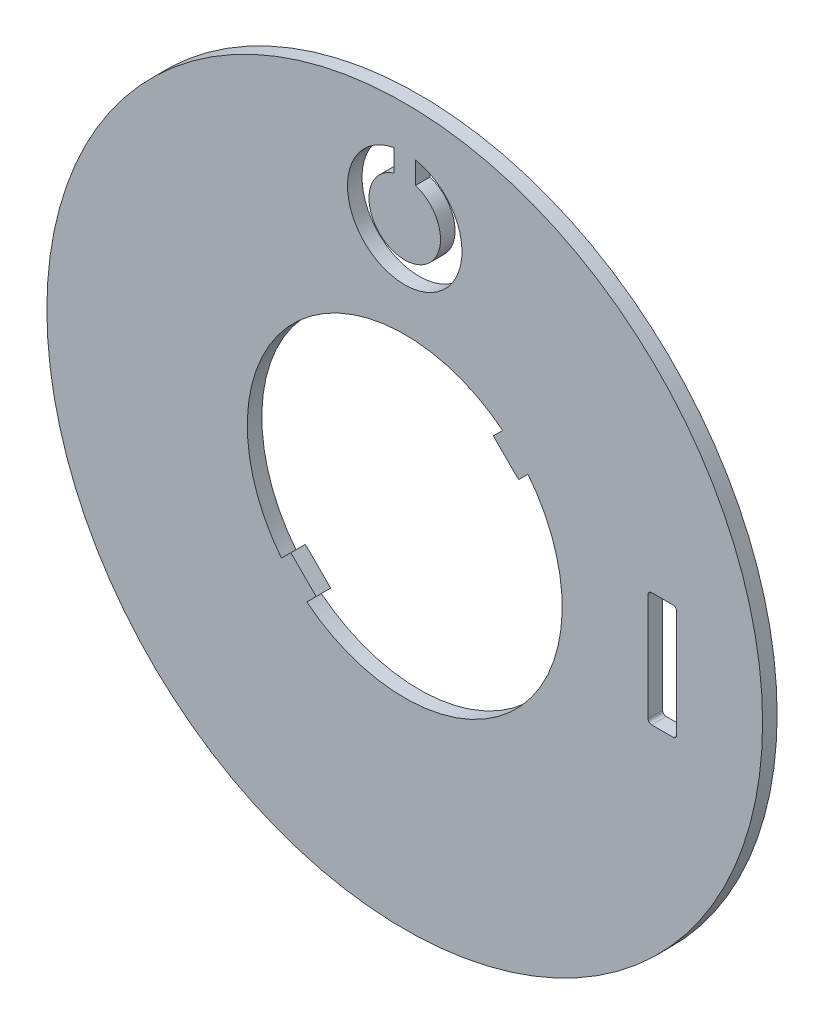
from build123d import *

# Parameters (mm, degrees)
SKETCH1_R           = 25
BOSS_EXTRUDE1_DEPTH = 1.016
CUT_EXTRUDE1_DEPTH  = 107.673671804


with BuildPart() as part:
    # Sketch1 → Boss-Extrude1 (new body)
    with BuildSketch(Plane.XY):
        with Locations((37.000000001, 61.8)):
            Circle(SKETCH1_R)
        with BuildLine():
            Line((43.843907282, 70.411674235), (43.187184336, 69.754951288))
            Line((43.187184336, 69.754951288), (44.954951289, 67.987184335))
            Line((44.954951289, 67.987184335), (45.611674235, 68.643907282))
            ThreePointArc((45.611674235, 68.643907282), (44.778174594, 54.021825407), (30.156092719, 53.188325765))
            Line((30.156092719, 53.188325765), (30.812815665, 53.845048712))
            Line((30.812815665, 53.845048712), (29.045048712, 55.612815665))
            Line((29.045048712, 55.612815665), (28.388325766, 54.956092718))
            ThreePointArc((28.388325766, 54.956092718), (29.221825408, 69.578174593), (43.843907282, 70.411674235))
        make_face(mode=Mode.SUBTRACT)
    extrude(amount=BOSS_EXTRUDE1_DEPTH)

    # Sketch2 → Cut-Extrude1 (cut, through all)
    with BuildSketch(Plane.XY):
        with BuildLine():
            ThreePointArc((36.250000001, 82.184848004), (37.000000001, 77.3), (37.750000001, 82.184848004))
            Line((37.750000001, 82.184848004), (37.750000001, 83.729058411))
            ThreePointArc((37.750000001, 83.729058411), (37.000000001, 75.8), (36.250000001, 83.729058411))
            Line((36.250000001, 83.729058411), (36.250000001, 82.184848004))
        make_face()
        with BuildLine():
            Line((54.250000001, 57.8), (55.750000001, 57.8))
            ThreePointArc((55.750000001, 57.8), (55.926776696, 57.873223305), (56.000000001, 58.05))
            Line((56.000000001, 58.05), (56.000000001, 65.55))
            ThreePointArc((56.000000001, 65.55), (55.926776696, 65.726776695), (55.750000001, 65.8))
            Line((55.750000001, 65.8), (54.250000001, 65.8))
            ThreePointArc((54.250000001, 65.8), (54.073223305, 65.726776695), (54.000000001, 65.55))
            Line((54.000000001, 65.55), (54.000000001, 58.05))
            ThreePointArc((54.000000001, 58.05), (54.073223305, 57.873223305), (54.250000001, 57.8))
        make_face()
    extrude(amount=CUT_EXTRUDE1_DEPTH, mode=Mode.SUBTRACT)


solid = part.part
